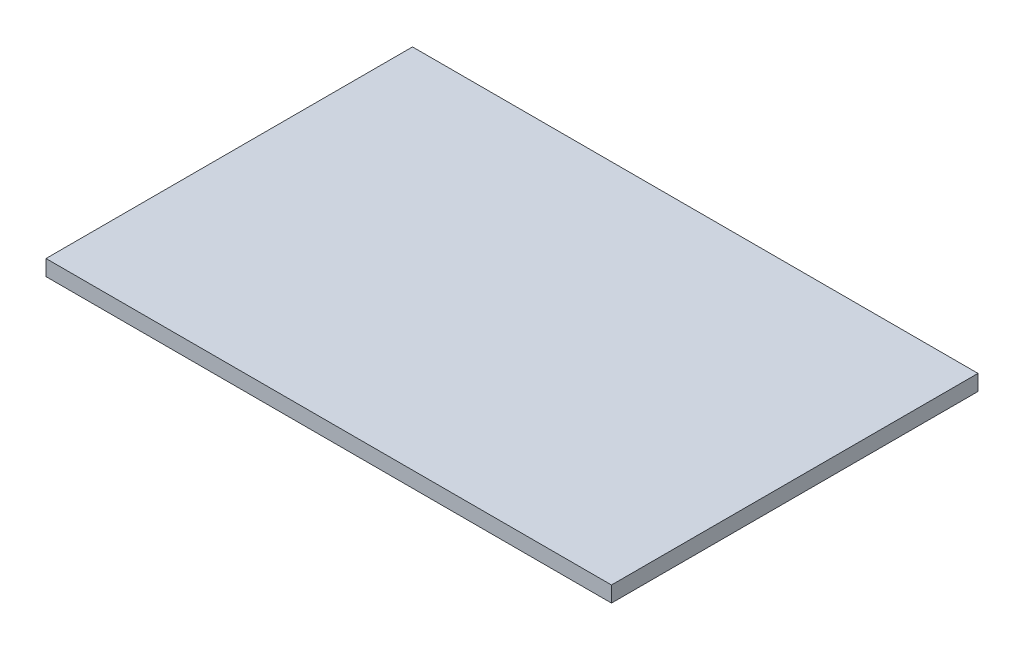
from build123d import *

# Parameters (mm, degrees)
SKETCH1_W           = 108
SKETCH1_H           = 70
BOSS_EXTRUDE1_DEPTH = 3


with BuildPart() as part:
    # Sketch1 → Boss-Extrude1 (new body)
    with BuildSketch(Plane(origin=(0, 0, 0), x_dir=(1, 0, 0), z_dir=(0, 1, 0))):
        Rectangle(SKETCH1_W, SKETCH1_H)
    extrude(amount=BOSS_EXTRUDE1_DEPTH)


solid = part.part
